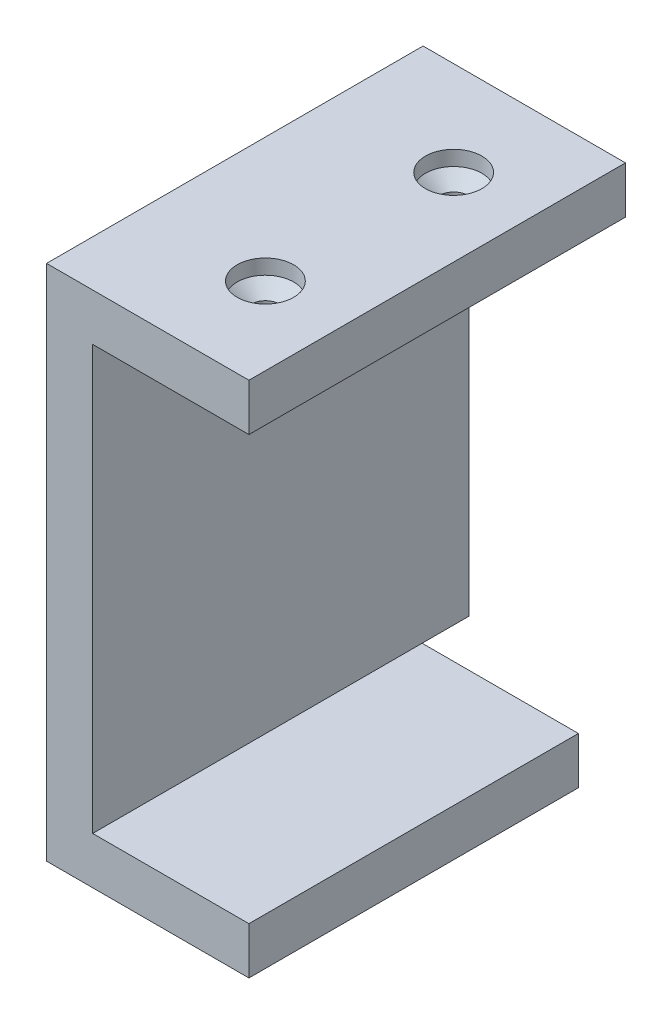
from build123d import *

# Parameters (mm, degrees)
BOSS_EXTRUDE1_DEPTH = 5
SKETCH2_W           = 4.9
SKETCH2_H           = 40
BOSS_EXTRUDE2_DEPTH = 45
SKETCH3_W           = 21.5
SKETCH3_H           = 35
BOSS_EXTRUDE3_DEPTH = 5
SKETCH4_R           = 3
CUT_EXTRUDE1_DEPTH  = 5


with BuildPart() as part:
    # Sketch1 → Boss-Extrude1 (new body)
    with BuildSketch(Plane(origin=(0, 0, 0), x_dir=(1, 0, 0), z_dir=(0, 1, 0))):
        Polygon((-7.5, -20), (9, -20), (9, 20), (-7.5, 20), (-12.5, 20), (-12.5, -20), align=None)
    extrude(amount=BOSS_EXTRUDE1_DEPTH)

    # Sketch2 → Boss-Extrude2 (add)
    with BuildSketch(Plane(origin=(0, 0, 0), x_dir=(1, 0, 0), z_dir=(0, 1, 0))):
        with Locations((-10.05, 0)):
            Rectangle(SKETCH2_W, SKETCH2_H)
    extrude(amount=-BOSS_EXTRUDE2_DEPTH)

    # Sketch3 → Boss-Extrude3 (add)
    with BuildSketch(Plane.XZ.offset(45)):
        with Locations((-1.75, 2.5)):
            Rectangle(SKETCH3_W, SKETCH3_H)
    extrude(amount=BOSS_EXTRUDE3_DEPTH)

    # Sketch4 → Cut-Extrude1 (cut)
    with BuildSketch(Plane.XZ):
        with Locations(Location((0.75, -10, 0), (0, 0, 270))):
            Circle(SKETCH4_R)
        with Locations(Location((0.75, 10, 0), (0, 0, 90))):
            Circle(SKETCH4_R)
    extrude(amount=-CUT_EXTRUDE1_DEPTH, mode=Mode.SUBTRACT)

    # Sketch5 → Revolve1 (revolve)
    with BuildSketch(Plane(origin=(0.75, 0, 0), x_dir=(0, -1, 0), z_dir=(-1, 0, 0))):
        Polygon((-3.415, 13), (-2.115, 11.52561463), (0, 11.52561463), (0, 13), align=None)
    revolve1 = revolve(axis=Axis((0.75, 5, 10), (0, -1, 0)))

    # Mirror1: Revolve1 across plane
    add(revolve1.mirror(Plane.XY))


solid = part.part
